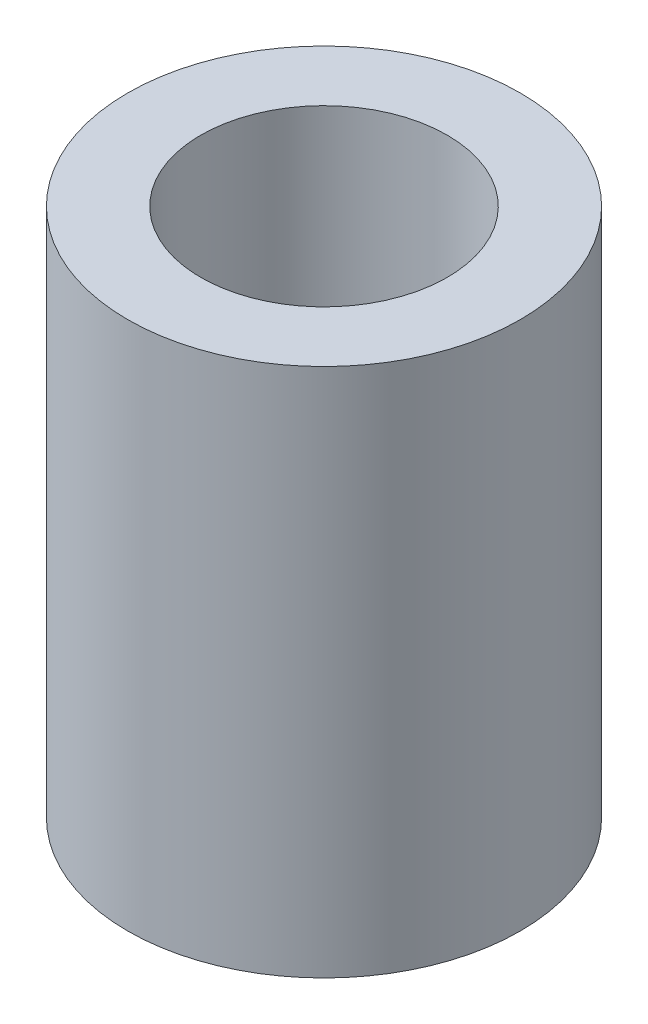
from build123d import *

# Parameters (mm, degrees)
SKETCH1_R           = 5.375
SKETCH1_R_2         = 3.375
BOSS_EXTRUDE1_DEPTH = 14.5


with BuildPart() as part:
    # Sketch1 → Boss-Extrude1 (new body)
    with BuildSketch(Plane(origin=(0, 0, 0), x_dir=(1, 0, 0), z_dir=(0, 1, 0))):
        with Locations(Location((0, 0, 0), (0, 0, 90))):
            Circle(SKETCH1_R)
        with Locations(Location((0, 0, 0), (0, 0, 90))):
            Circle(SKETCH1_R_2, mode=Mode.SUBTRACT)
    extrude(amount=BOSS_EXTRUDE1_DEPTH)


solid = part.part
